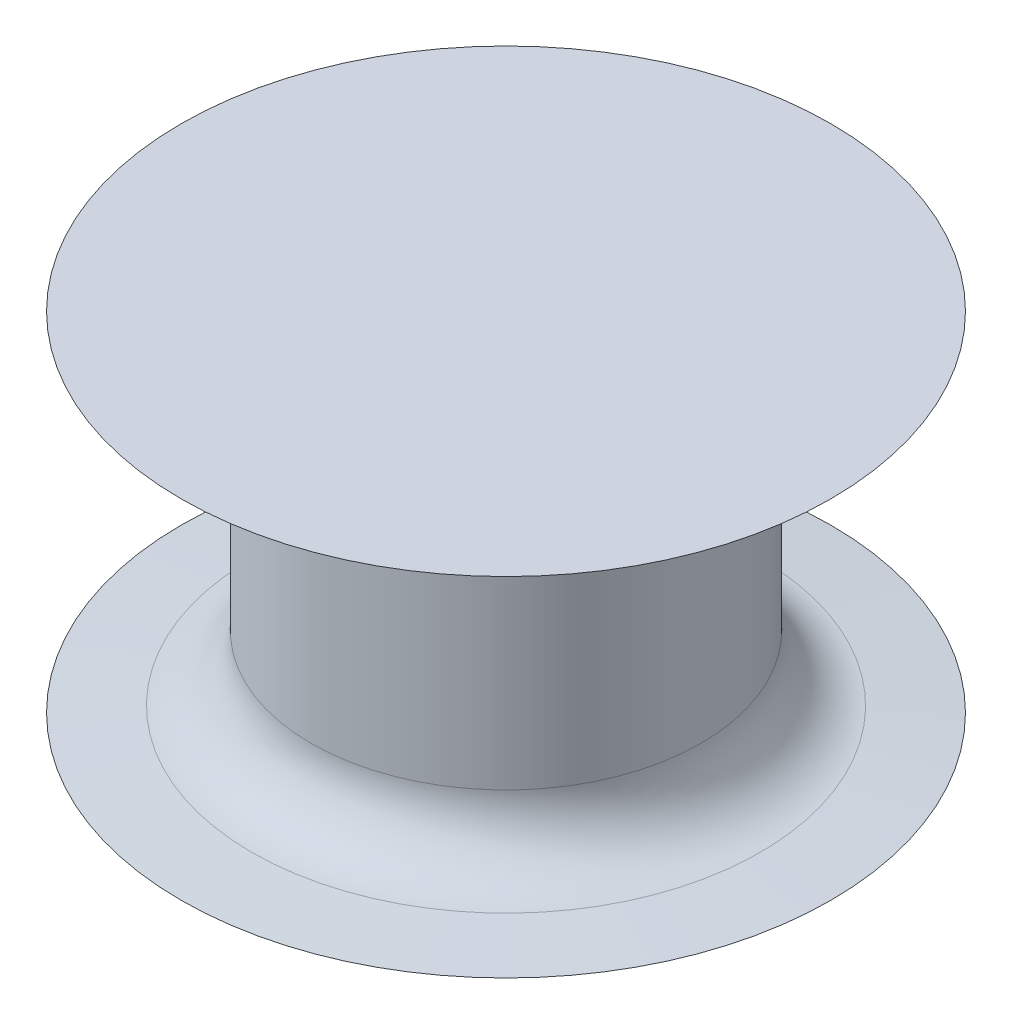
from build123d import *

# Parameters (mm, degrees)
SKETCH1_R            = 1.5
BOSS_EXTRUDE1_DEPTH  = 2.5
FILLET1_R            = 0.5
FILLET1_OF_MIRROR1_R = 0.5


with BuildPart() as part:
    # Sketch1 → Boss-Extrude1 (new body)
    with BuildSketch(Plane(origin=(0, 0, 0), x_dir=(1, 0, 0), z_dir=(0, 1, 0))):
        with Locations(Location((0, 0, 0), (0, 0, 270))):
            Circle(SKETCH1_R)
    extrude(amount=BOSS_EXTRUDE1_DEPTH)

    # Sketch3 → Revolve1 (revolve)
    with BuildSketch(Plane(origin=(0, 0, 0), x_dir=(0, 0, -1), z_dir=(1, 0, 0)), mode=Mode.PRIVATE) as revolve1_sk:
        Polygon((1.5, 2.5), (2.5, 2.587488664), (0, 2.587488664), (0, 1.587488664), (1.5, 1.587488664), align=None)
    revolve1 = revolve(revolve1_sk.sketch.rotate(Axis((0, 2.587488664, 0), (0, -1, 0)), 180), axis=Axis((0, 2.587488664, 0), (0, -1, 0)))

    # Fillet1
    fillet1_edges = [part.edges().sort_by_distance(p)[0] for p in [
        (0, 2.5, -1.5),
    ]]
    fillet(fillet1_edges, radius=FILLET1_R)

    # Mirror1: Revolve1 across plane
    add(revolve1.mirror(Plane(origin=(0, 1.25, 0), x_dir=(0, 0, 1), z_dir=(0, -1, 0))))

    # Fillet1 of Mirror1
    fillet1_of_mirror1_edges = [part.edges().sort_by_distance(p)[0] for p in [
        (0, 0, -1.5),
    ]]
    fillet(fillet1_of_mirror1_edges, radius=FILLET1_OF_MIRROR1_R)


solid = part.part
